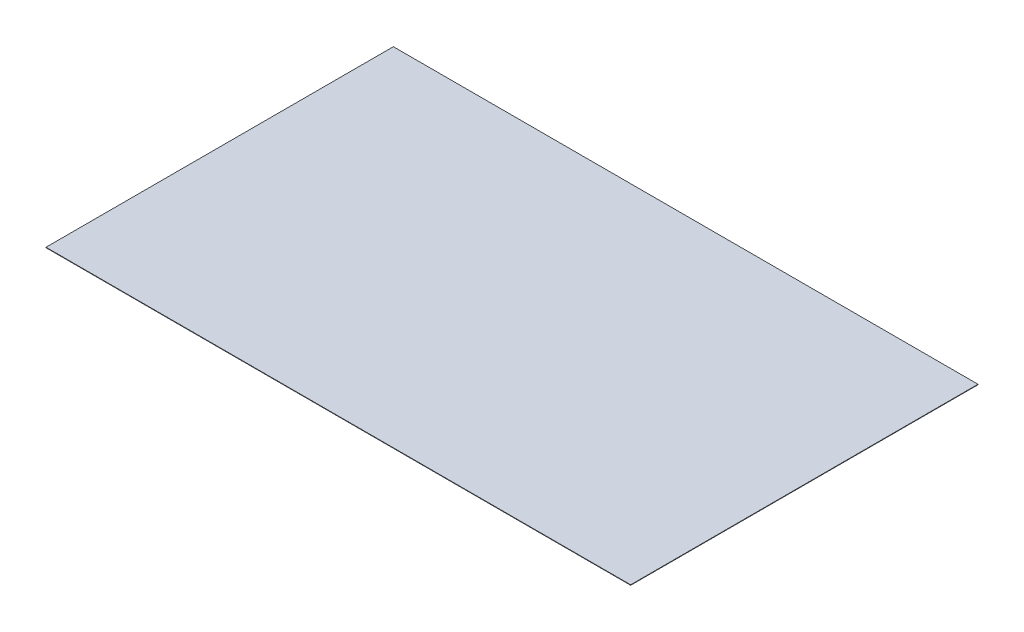
from build123d import *

# Parameters (mm, degrees)
SKETCH1_W                     = 1275
SKETCH1_H                     = 1
STORE_AYIRICI_SAC_UST_1_DEPTH = 757.5


with BuildPart() as part:
    # Sketch1 → STORE_ayirici_sac_ust_1 (new body)
    with BuildSketch(Plane.XY):
        with Locations((700, 765.5)):
            Rectangle(SKETCH1_W, SKETCH1_H)
    extrude(amount=-STORE_AYIRICI_SAC_UST_1_DEPTH)


solid = part.part
